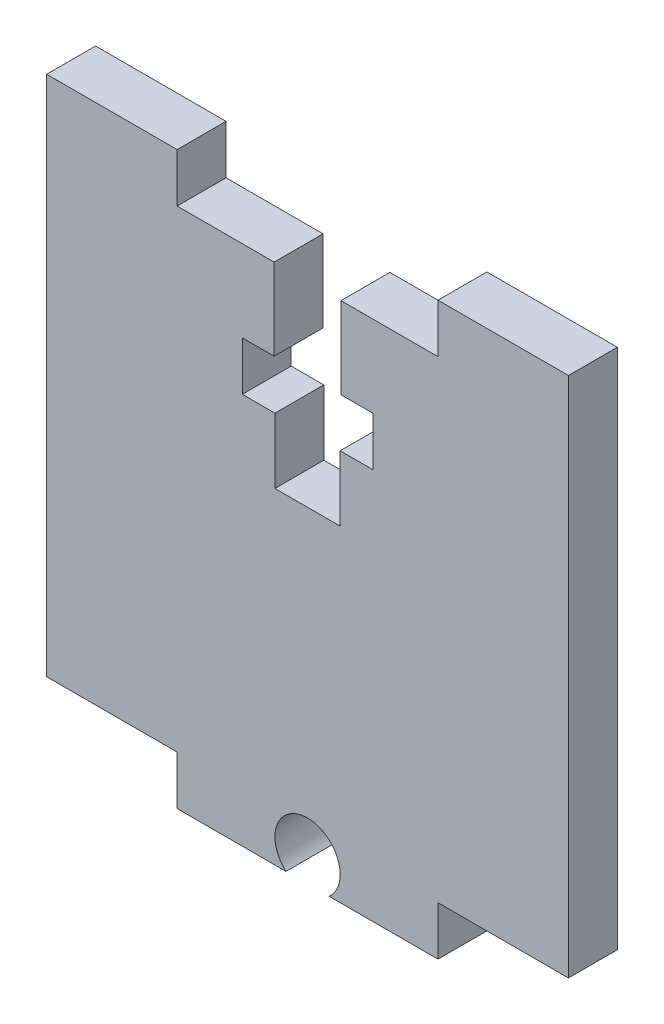
from build123d import *

# Parameters (mm, degrees)
EXTRUDE_1_DEPTH = 3


with BuildPart() as part:
    # 草图2 → 凸台-拉伸1 (new body)
    with BuildSketch(Plane.XY):
        with BuildLine():
            Line((2.047890023, 48.855305477), (8, 48.855305477))
            Line((8, 48.855305477), (8, 51.855305477))
            Line((8, 51.855305477), (16, 51.855305477))
            Line((16, 51.855305477), (16, 19.855305477))
            Line((16, 19.855305477), (8, 19.855305477))
            Line((8, 19.855305477), (8, 16.855305477))
            Line((8, 16.855305477), (1.322875656, 16.855305477))
            ThreePointArc((1.322875656, 16.855305477), (0, 20.355305477), (-1.322875656, 16.855305477))
            Line((-1.322875656, 16.855305477), (-8, 16.855305477))
            Line((-8, 16.855305477), (-8, 19.855305477))
            Line((-8, 19.855305477), (-16, 19.855305477))
            Line((-16, 19.855305477), (-16, 51.855305477))
            Line((-16, 51.855305477), (-8, 51.855305477))
            Line((-8, 51.855305477), (-8, 48.855305477))
            Line((-8, 48.855305477), (-2.047890023, 48.855305477))
            Line((-2.047890023, 48.855305477), (-2.047890023, 43.855305477))
            Line((-2.047890023, 43.855305477), (-4, 43.855305477))
            Line((-4, 43.855305477), (-4, 40.855305477))
            Line((-4, 40.855305477), (-2, 40.855305477))
            Line((-2, 40.855305477), (-2, 36.855305477))
            Line((-2, 36.855305477), (2, 36.855305477))
            Line((2, 36.855305477), (2, 40.855305477))
            Line((2, 40.855305477), (4, 40.855305477))
            Line((4, 40.855305477), (4, 43.855305477))
            Line((4, 43.855305477), (2.047890023, 43.855305477))
            Line((2.047890023, 43.855305477), (2.047890023, 48.855305477))
        make_face()
    extrude(amount=EXTRUDE_1_DEPTH)


solid = part.part
